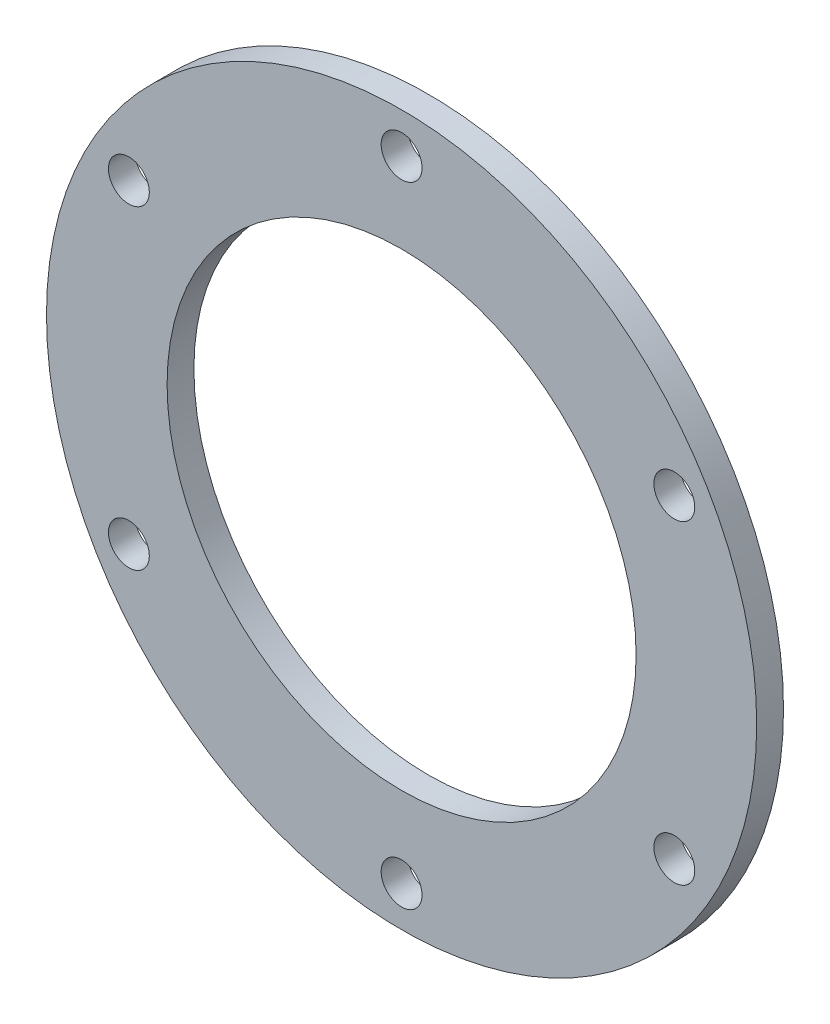
from build123d import *

# Parameters (mm, degrees)
SKETCH_1_R          = 26.5
SKETCH_1_R_2        = 17.5
EXTRUDE_1_DEPTH     = 2
SKETCH_2_R          = 1.525
CUT_EXTRUDE_1_DEPTH = 2


with BuildPart() as part:
    # 草图1 → 凸台-拉伸1 (new body)
    with BuildSketch(Plane.XY):
        Circle(SKETCH_1_R)
        Circle(SKETCH_1_R_2, mode=Mode.SUBTRACT)
    extrude(amount=EXTRUDE_1_DEPTH)

    # 草图2 → 切除-拉伸1 (cut)
    with BuildSketch(Plane.XY.offset(2)):
        with Locations((0, 23.5)):
            Circle(SKETCH_2_R)
        with Locations((20.351596989, 11.75)):
            Circle(SKETCH_2_R)
        with Locations((20.351596989, -11.75)):
            Circle(SKETCH_2_R)
        with Locations((0, -23.5)):
            Circle(SKETCH_2_R)
        with Locations((-20.351596989, -11.75)):
            Circle(SKETCH_2_R)
        with Locations((-20.351596989, 11.75)):
            Circle(SKETCH_2_R)
    extrude(amount=-CUT_EXTRUDE_1_DEPTH, mode=Mode.SUBTRACT)


solid = part.part
